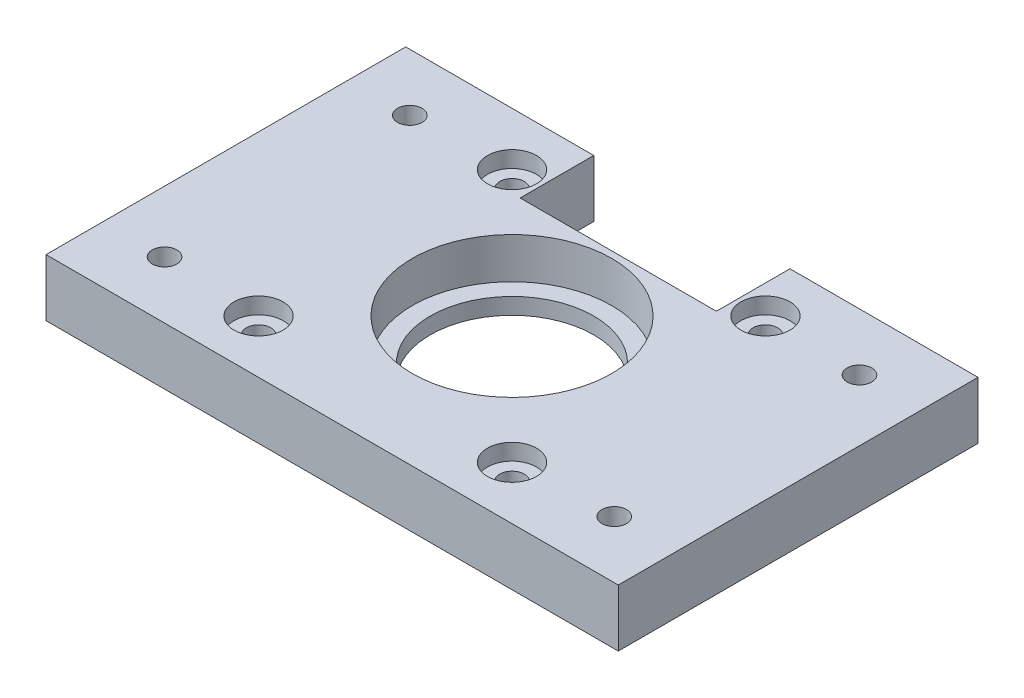
from build123d import *

# Parameters (mm, degrees)
SKETCH1_R           = 12.2
SKETCH1_R_2         = 1.5
BOSS_EXTRUDE1_DEPTH = 7
SKETCH2_R           = 12.2
SKETCH2_R_2         = 10
BOSS_EXTRUDE2_DEPTH = 2
SKETCH3_R           = 3
CUT_EXTRUDE1_DEPTH  = 2
SKETCH4_R           = 3
CUT_EXTRUDE2_DEPTH  = 2


with BuildPart() as part:
    # Sketch1 → Boss-Extrude1 (new body)
    with BuildSketch(Plane(origin=(0, 0, 0), x_dir=(1, 0, 0), z_dir=(0, 1, 0))):
        Polygon((-12, 22), (-12, 13), (12, 13), (12, 22), (35, 22), (35, -22), (-35, -22), (-35, 22), align=None)
        with Locations(Location((0, 0, 0), (0, 0, 270))):
            Circle(SKETCH1_R, mode=Mode.SUBTRACT)
        with Locations(Location((27.5, -15, 0), (0, 0, 270))):
            Circle(SKETCH1_R_2, mode=Mode.SUBTRACT)
        with Locations(Location((27.5, 15, 0), (0, 0, 270))):
            Circle(SKETCH1_R_2, mode=Mode.SUBTRACT)
        with Locations(Location((-27.5, -15, 0), (0, 0, 270))):
            Circle(SKETCH1_R_2, mode=Mode.SUBTRACT)
        with Locations(Location((-27.5, 15, 0), (0, 0, 270))):
            Circle(SKETCH1_R_2, mode=Mode.SUBTRACT)
        with Locations(Location((15.5, -15.5, 0), (0, 0, 270))):
            Circle(SKETCH1_R_2, mode=Mode.SUBTRACT)
        with Locations(Location((-15.5, -15.5, 0), (0, 0, 270))):
            Circle(SKETCH1_R_2, mode=Mode.SUBTRACT)
        with Locations(Location((15.5, 15.5, 0), (0, 0, 270))):
            Circle(SKETCH1_R_2, mode=Mode.SUBTRACT)
        with Locations(Location((-15.5, 15.5, 0), (0, 0, 270))):
            Circle(SKETCH1_R_2, mode=Mode.SUBTRACT)
    extrude(amount=BOSS_EXTRUDE1_DEPTH)

    # Sketch2 → Boss-Extrude2 (add)
    with BuildSketch(Plane.XZ):
        with Locations(Location((0, 0, 0), (0, 0, 270))):
            Circle(SKETCH2_R)
        with Locations(Location((0, 0, 0), (0, 0, 270))):
            Circle(SKETCH2_R_2, mode=Mode.SUBTRACT)
    extrude(amount=-BOSS_EXTRUDE2_DEPTH)

    # Sketch3 → Cut-Extrude1 (cut)
    with BuildSketch(Plane.XZ):
        with Locations(Location((-27.5, 15, 0), (0, 0, 270))):
            Circle(SKETCH3_R)
        with Locations(Location((-27.5, -15, 0), (0, 0, 270))):
            Circle(SKETCH3_R)
        with Locations(Location((27.5, 15, 0), (0, 0, 270))):
            Circle(SKETCH3_R)
        with Locations(Location((27.5, -15, 0), (0, 0, 270))):
            Circle(SKETCH3_R)
    extrude(amount=-CUT_EXTRUDE1_DEPTH, mode=Mode.SUBTRACT)

    # Sketch4 → Cut-Extrude2 (cut)
    with BuildSketch(Plane(origin=(0, 7, 0), x_dir=(1, 0, 0), z_dir=(0, 1, 0))):
        with Locations(Location((15.5, -15.5, 0), (0, 0, 270))):
            Circle(SKETCH4_R)
        with Locations(Location((-15.5, -15.5, 0), (0, 0, 270))):
            Circle(SKETCH4_R)
        with Locations(Location((15.5, 15.5, 0), (0, 0, 270))):
            Circle(SKETCH4_R)
        with Locations(Location((-15.5, 15.5, 0), (0, 0, 270))):
            Circle(SKETCH4_R)
    extrude(amount=-CUT_EXTRUDE2_DEPTH, mode=Mode.SUBTRACT)


solid = part.part
